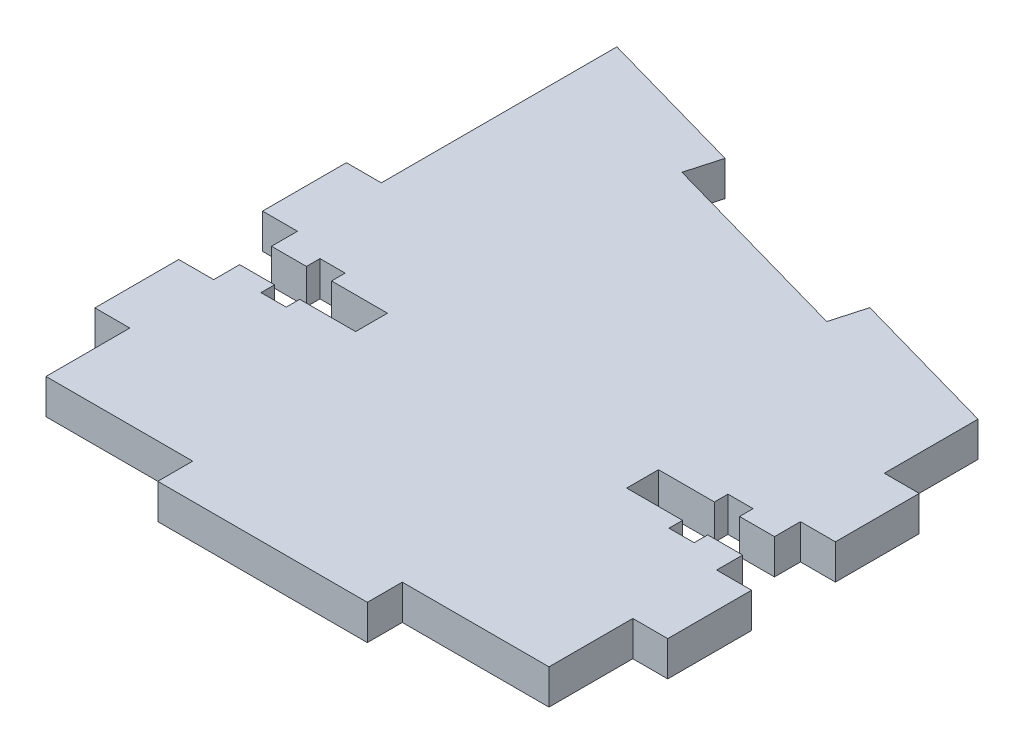
from build123d import *

# Parameters (mm, degrees)
BOSS_EXTRUDE1_DEPTH = 3.175
CUT_EXTRUDE1_DEPTH  = 72.369475764


with BuildPart() as part:
    # Sketch1 → Boss-Extrude1 (new body)
    with BuildSketch(Plane(origin=(0, 0, 0), x_dir=(1, 0, 0), z_dir=(0, 1, 0))):
        Polygon((0, 0), (13.335, 0), (13.335, -3.175), (32.385, -3.175), (32.385, 0), (45.72, 0), (45.72, 7.62), (48.895, 7.62), (48.895, 15.24), (45.72, 15.24), (45.72, 22.86), (48.895, 22.86), (48.895, 30.48), (45.72, 30.48), (45.72, 38.99662), (32.027322928, 42.858715639), (31.165424808, 39.802941329), (12.830778951, 44.974330052), (13.692677072, 48.030104361), (0, 51.8922), (0, 30.48), (-3.175, 30.48), (-3.175, 22.86), (0, 22.86), (0, 15.24), (-3.175, 15.24), (-3.175, 7.62), (0, 7.62), align=None)
    extrude(amount=BOSS_EXTRUDE1_DEPTH)

    # Sketch2 → Cut-Extrude1 (cut, through all)
    with BuildSketch(Plane(origin=(0, 3.175, 0), x_dir=(1, 0, 0), z_dir=(0, 1, 0))):
        Polygon((0, 20.4978), (3.175, 20.4978), (3.175, 21.7297), (5.461, 21.7297), (5.461, 20.4978), (10.541, 20.4978), (10.541, 17.6022), (5.461, 17.6022), (5.461, 16.3703), (3.175, 16.3703), (3.175, 17.6022), (0, 17.6022), align=None)
        Polygon((42.545, 17.6022), (45.72, 17.6022), (45.72, 20.4978), (42.545, 20.4978), (42.545, 21.7297), (40.259, 21.7297), (40.259, 20.4978), (35.179, 20.4978), (35.179, 17.6022), (40.259, 17.6022), (40.259, 16.3703), (42.545, 16.3703), align=None)
    extrude(amount=-CUT_EXTRUDE1_DEPTH, mode=Mode.SUBTRACT)


solid = part.part
